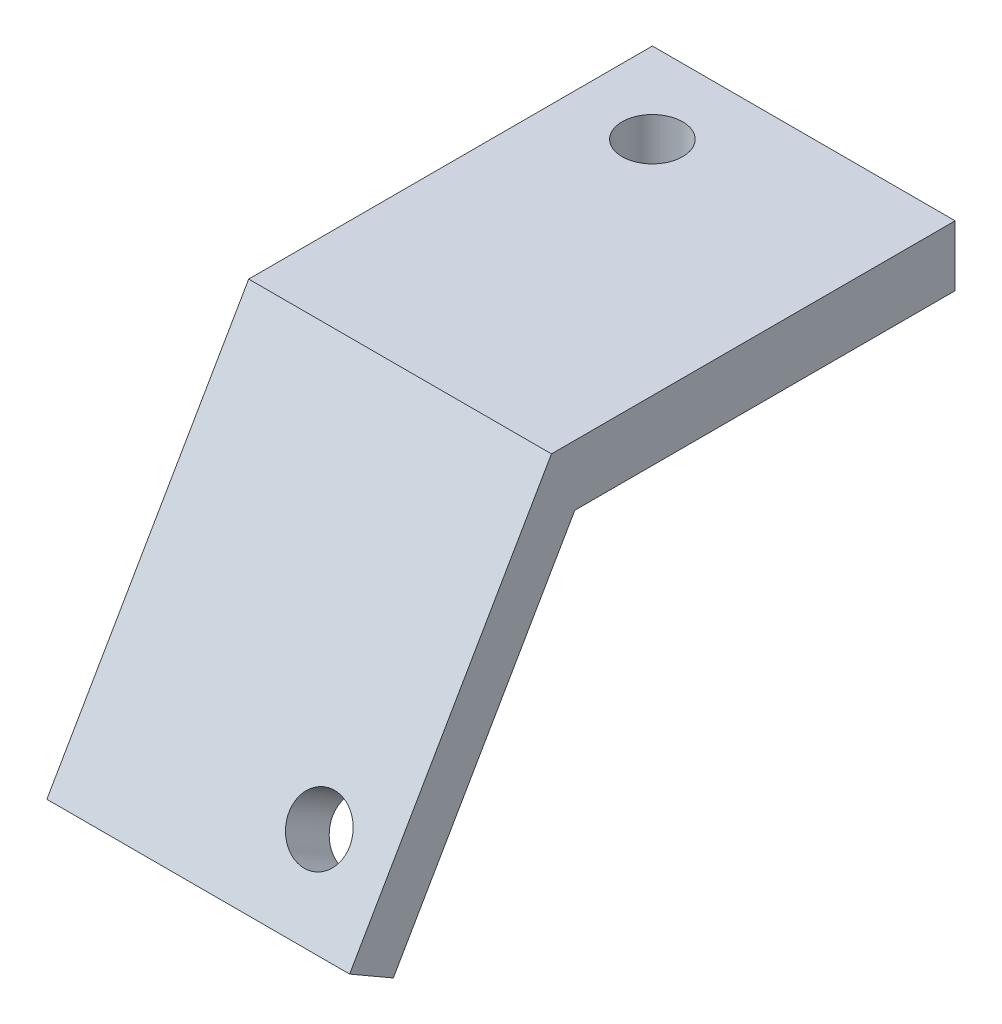
from build123d import *

# Parameters (mm, degrees)
SKETCH1_W           = 15
SKETCH1_H           = 20
SKETCH1_R           = 1.5
BOSS_EXTRUDE1_DEPTH = 3
SKETCH2_W           = 15
SKETCH2_H           = 2.5
BOSS_EXTRUDE2_DEPTH = 20
SKETCH3_R           = 1.5
CUT_EXTRUDE1_DEPTH  = 10


with BuildPart() as part:
    # Sketch1 → Boss-Extrude1 (new body)
    with BuildSketch(Plane(origin=(0, 0, 0), x_dir=(1, 0, 0), z_dir=(0, 1, 0))):
        Rectangle(SKETCH1_W, SKETCH1_H)
        with Locations(Location((-3.5, 6, 0), (0, 0, 270))):
            Circle(SKETCH1_R, mode=Mode.SUBTRACT)
    extrude(amount=BOSS_EXTRUDE1_DEPTH)

    # Sketch2 → Boss-Extrude2 (add)
    with BuildSketch(Plane(origin=(0, -2.080127019, 1.200961894), x_dir=(1, 0, 0), z_dir=(0, 0.8660254037844364, -0.5000000000000041))):
        with Locations((0, -8.910254038)):
            Rectangle(SKETCH2_W, SKETCH2_H)
    extrude(amount=-BOSS_EXTRUDE2_DEPTH)

    # Sketch3 → Cut-Extrude1 (cut)
    with BuildSketch(Plane(origin=(0, 5.080127019, 8.799038106), x_dir=(1, 0, 0), z_dir=(0, 0.500000000000004, 0.8660254037844364))):
        with Locations(Location((4, -18.401923789, 0), (0, 0, 270))):
            Circle(SKETCH3_R)
    extrude(amount=-CUT_EXTRUDE1_DEPTH, mode=Mode.SUBTRACT)


solid = part.part
